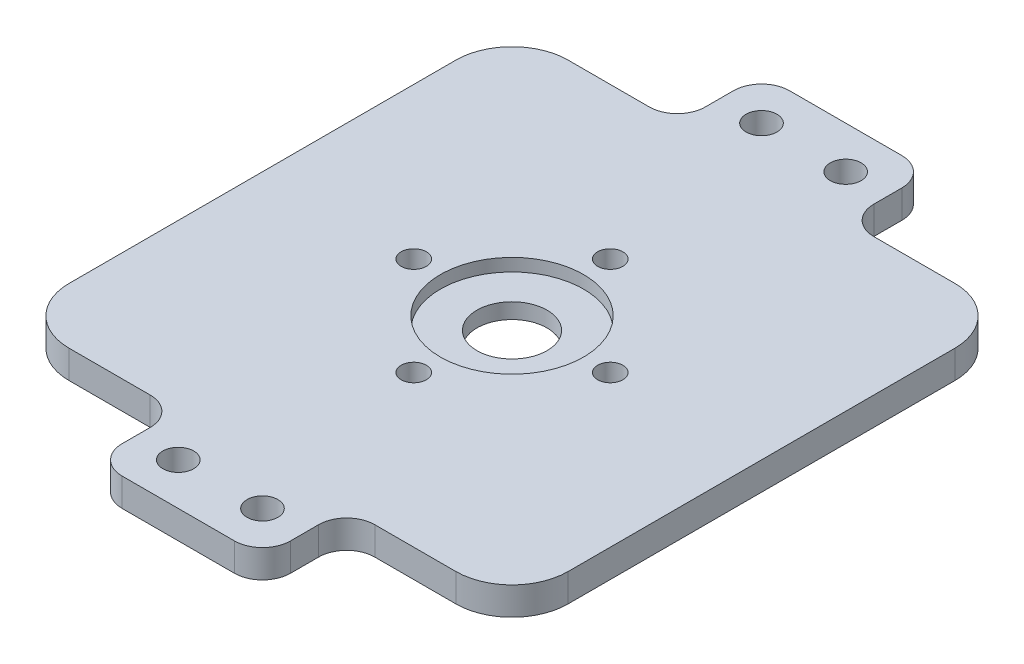
from build123d import *

# Parameters (mm, degrees)
SKETCH1_R           = 2.25
SKETCH1_R_2         = 2.75
SKETCH1_R_3         = 6.25
BOSS_EXTRUDE1_DEPTH = 5
FILLET1_R           = 10
FILLET2_R           = 5
SKETCH2_R           = 12.75
CUT_EXTRUDE1_DEPTH  = 2.25


with BuildPart() as part:
    # Sketch1 → Boss-Extrude1 (new body)
    with BuildSketch(Plane(origin=(0, 0, 0), x_dir=(1, 0, 0), z_dir=(0, 1, 0))):
        Polygon((0, 88.9), (0, 0), (29.45, 0), (29.45, -15), (59.45, -15), (59.45, 0), (88.9, 0), (88.9, 88.9), (59.45, 88.9), (59.45, 103.9), (29.45, 103.9), (29.45, 88.9), align=None)
        with Locations(Location((61.95, 44.45, 0), (0, 0, 270))):
            Circle(SKETCH1_R, mode=Mode.SUBTRACT)
        with Locations(Location((44.45, 26.95, 0), (0, 0, 270))):
            Circle(SKETCH1_R, mode=Mode.SUBTRACT)
        with Locations(Location((26.95, 44.45, 0), (0, 0, 270))):
            Circle(SKETCH1_R, mode=Mode.SUBTRACT)
        with Locations(Location((44.45, 61.95, 0), (0, 0, 270))):
            Circle(SKETCH1_R, mode=Mode.SUBTRACT)
        with Locations(Location((36.95, -7.5, 0), (0, 0, 270))):
            Circle(SKETCH1_R_2, mode=Mode.SUBTRACT)
        with Locations(Location((51.95, -7.5, 0), (0, 0, 270))):
            Circle(SKETCH1_R_2, mode=Mode.SUBTRACT)
        with Locations(Location((36.95, 96.4, 0), (0, 0, 270))):
            Circle(SKETCH1_R_2, mode=Mode.SUBTRACT)
        with Locations(Location((51.95, 96.4, 0), (0, 0, 270))):
            Circle(SKETCH1_R_2, mode=Mode.SUBTRACT)
        with Locations(Location((44.45, 44.45, 0), (0, 0, 270))):
            Circle(SKETCH1_R_3, mode=Mode.SUBTRACT)
    extrude(amount=BOSS_EXTRUDE1_DEPTH)

    # Fillet1
    fillet1_edges = [part.edges().sort_by_distance(p)[0] for p in [
        (0, 2.5, 0),
        (0, 2.5, -88.9),
        (88.9, 2.5, -88.9),
        (88.9, 2.5, 0),
    ]]
    fillet(fillet1_edges, radius=FILLET1_R)

    # Fillet2
    fillet2_edges = [part.edges().sort_by_distance(p)[0] for p in [
        (29.45, 2.5, 15),
        (29.45, 2.5, 0),
        (29.45, 2.5, -88.9),
        (29.45, 2.5, -103.9),
        (59.45, 2.5, -103.9),
        (59.45, 2.5, -88.9),
        (59.45, 2.5, 0),
        (59.45, 2.5, 15),
    ]]
    fillet(fillet2_edges, radius=FILLET2_R)

    # Sketch2 → Cut-Extrude1 (cut)
    with BuildSketch(Plane(origin=(0, 5, 0), x_dir=(1, 0, 0), z_dir=(0, 1, 0))):
        with Locations(Location((44.45, 44.45, 0), (0, 0, 270))):
            Circle(SKETCH2_R)
    extrude(amount=-CUT_EXTRUDE1_DEPTH, mode=Mode.SUBTRACT)


solid = part.part
